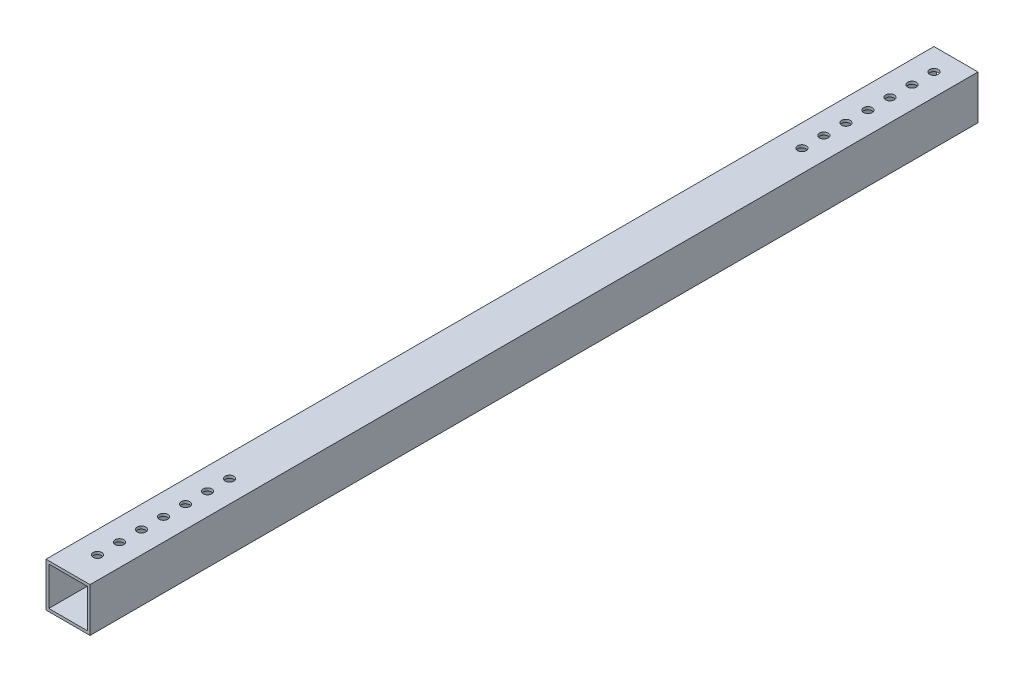
from build123d import *

# Parameters (mm, degrees)
SKETCH1_W               = 25.4
SKETCH1_H               = 25.4
BOSS_EXTRUDE1_DEPTH     = 256.145698528
SHELL1_T                = -1.5875
CUT_EXTRUDE1_DEPTH      = 257.774607145
CUT_EXTRUDE1_DEPTH_BACK = 257.774607145
SKETCH3_R               = 2.4892


with BuildPart() as part:
    # Sketch1 → Boss-Extrude1 (new, symmetric)
    with BuildSketch(Plane.XY):
        Rectangle(SKETCH1_W, SKETCH1_H)
    extrude(amount=BOSS_EXTRUDE1_DEPTH, both=True)

    # Shell1
    shell1_openings = [part.faces().sort_by_distance(p)[0] for p in [
        (0, 0, 256.145698528),
        (0, 0, -256.145698528),
    ]]
    offset(amount=SHELL1_T, openings=shell1_openings, kind=Kind.INTERSECTION)

    # Sketch3 → Cut-Extrude1 (cut, two sides: drawn at the far end of the back side and taken through both)
    with BuildSketch(Plane(origin=(0, 0, 0), x_dir=(1, 0, 0), z_dir=(0, 1, 0)).offset(-CUT_EXTRUDE1_DEPTH_BACK)):
        with Locations(Location((0, 243.445698528, 0), (0, 0, 270))):
            Circle(SKETCH3_R)
        with Locations(Location((0, 230.745698528, 0), (0, 0, 270))):
            Circle(SKETCH3_R)
        with Locations(Location((0, 218.045698528, 0), (0, 0, 270))):
            Circle(SKETCH3_R)
        with Locations(Location((0, 205.345698528, 0), (0, 0, 270))):
            Circle(SKETCH3_R)
        with Locations(Location((0, 192.645698528, 0), (0, 0, 270))):
            Circle(SKETCH3_R)
        with Locations(Location((0, 179.945698528, 0), (0, 0, 270))):
            Circle(SKETCH3_R)
        with Locations(Location((0, 167.245698528, 0), (0, 0, 270))):
            Circle(SKETCH3_R)
        with Locations(Location((0, -162.954301472, 0), (0, 0, 270))):
            Circle(SKETCH3_R)
        with Locations(Location((0, -175.654301472, 0), (0, 0, 270))):
            Circle(SKETCH3_R)
        with Locations(Location((0, -188.354301472, 0), (0, 0, 270))):
            Circle(SKETCH3_R)
        with Locations(Location((0, -201.054301472, 0), (0, 0, 270))):
            Circle(SKETCH3_R)
        with Locations(Location((0, -213.754301472, 0), (0, 0, 270))):
            Circle(SKETCH3_R)
        with Locations(Location((0, -226.454301472, 0), (0, 0, 270))):
            Circle(SKETCH3_R)
        with Locations(Location((0, -239.154301472, 0), (0, 0, 270))):
            Circle(SKETCH3_R)
    extrude(amount=CUT_EXTRUDE1_DEPTH + CUT_EXTRUDE1_DEPTH_BACK, mode=Mode.SUBTRACT)


solid = part.part
